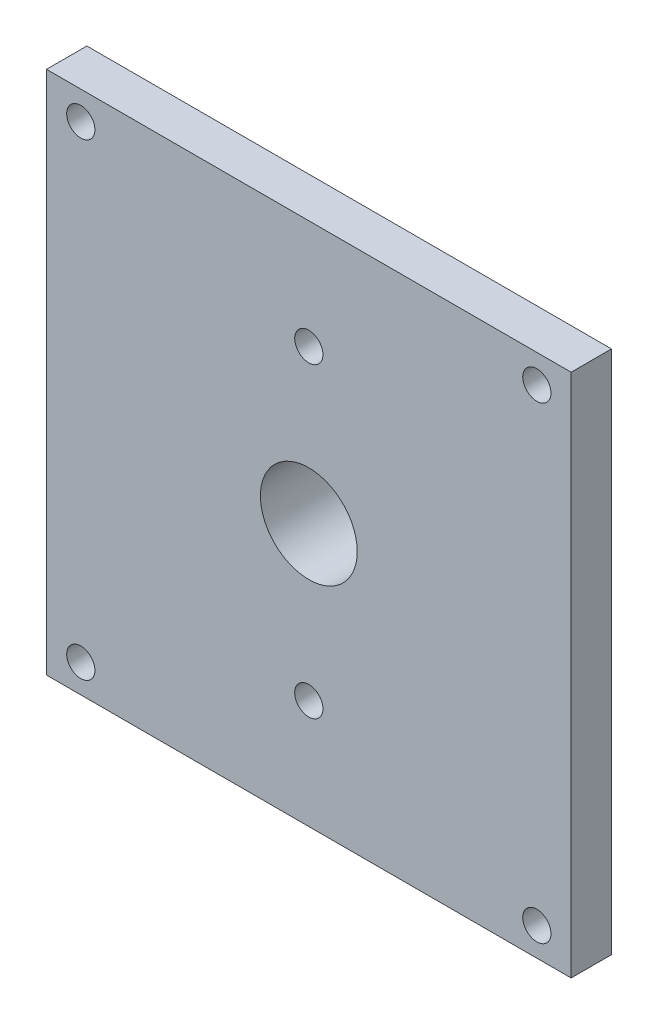
from build123d import *

# Parameters (mm, degrees)
SKETCH1_R           = 15
BOSS_EXTRUDE1_DEPTH = 20
SKETCH2_R           = 8
CUT_EXTRUDE1_DEPTH  = 5
SKETCH4_W           = 65
SKETCH4_H           = 65
BOSS_EXTRUDE2_DEPTH = 5
SKETCH3_R           = 6
CUT_EXTRUDE2_DEPTH  = 51.124844139
SKETCH5_R           = 1.75
CUT_EXTRUDE3_DEPTH  = 49.347699015
SKETCH6_R           = 1.75
CUT_EXTRUDE4_DEPTH  = 51.124844139


with BuildPart() as part:
    # Sketch1 → Boss-Extrude1 (new body)
    with BuildSketch(Plane.XY):
        Circle(SKETCH1_R)
    extrude(amount=-BOSS_EXTRUDE1_DEPTH)

    # Sketch2 → Cut-Extrude1 (cut)
    with BuildSketch(Plane(origin=(0, 0, -20), x_dir=(-1, 0, 0), z_dir=(0, 0, -1))):
        Circle(SKETCH2_R)
    extrude(amount=-CUT_EXTRUDE1_DEPTH, mode=Mode.SUBTRACT)

    # Sketch4 → Boss-Extrude2 (add)
    with BuildSketch(Plane.XY):
        Rectangle(SKETCH4_W, SKETCH4_H)
    extrude(amount=-BOSS_EXTRUDE2_DEPTH)

    # Sketch3 → Cut-Extrude2 (cut, through all)
    with BuildSketch(Plane.XY):
        Circle(SKETCH3_R)
    extrude(amount=-CUT_EXTRUDE2_DEPTH, mode=Mode.SUBTRACT)

    # Sketch5 → Cut-Extrude3 (cut, through all)
    with BuildSketch(Plane(origin=(0, 0, -5), x_dir=(-1, 0, 0), z_dir=(0, 0, -1))):
        with Locations((-28.25, 29)):
            Circle(SKETCH5_R)
        with Locations(Location((28.25, 29, 0), (0, 0, 180))):
            Circle(SKETCH5_R)
        with Locations((28.25, -29)):
            Circle(SKETCH5_R)
        with Locations(Location((-28.25, -29, 0), (0, 0, 180))):
            Circle(SKETCH5_R)
    extrude(amount=-CUT_EXTRUDE3_DEPTH, mode=Mode.SUBTRACT)

    # Sketch6 → Cut-Extrude4 (cut, through all)
    with BuildSketch(Plane.XY):
        with Locations((0, 19)):
            Circle(SKETCH6_R)
        with Locations((0, -19)):
            Circle(SKETCH6_R)
    extrude(amount=-CUT_EXTRUDE4_DEPTH, mode=Mode.SUBTRACT)


solid = part.part
